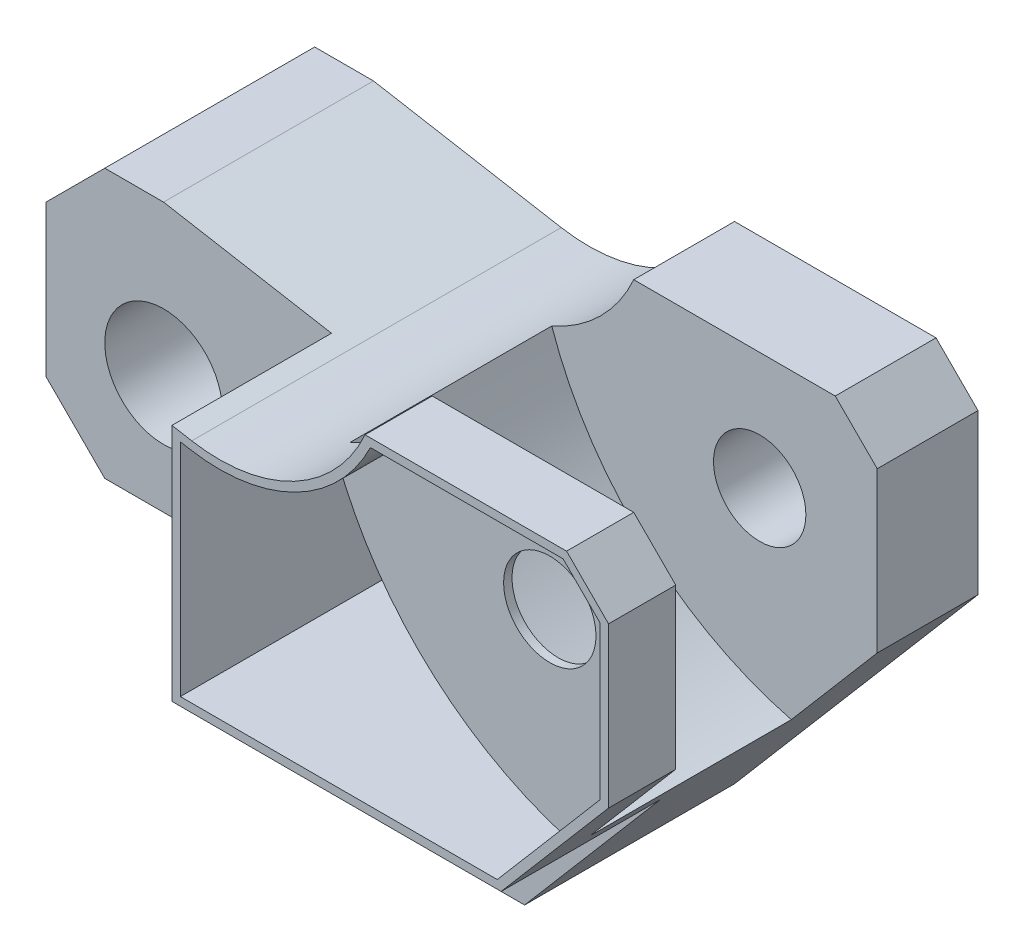
from build123d import *

# Parameters (mm, degrees)
ESQUISSE1_R              = 7
BOSS_EXTRU_2_DEPTH       = 44
ENL_V_START              = -19
ESQUISSE2_R              = 7
ENL_V_MAT_EXTRU_1_DEPTH  = 19
ENL_V_MAT_EXTRU_2_DEPTH  = 19
ESQUISSE3_R              = 5.5
ENL_V_MAT_EXTRU_3_DEPTH  = 103.815841668
ENL_V_MAT_EXTRU_21_DEPTH = 24
ENL_V_MAT_EXTRU_22_DEPTH = 7
ENL_V_MAT_EXTRU_23_DEPTH = 25


with BuildPart() as part:
    # Esquisse1 → Boss.-Extru.2 (new body)
    with BuildSketch(Plane.XY):
        with BuildLine():
            Line((40.010307264, -4.230818644), (64.010307264, -4.230818644))
            Line((64.010307264, -4.230818644), (69.010307264, -9.230818644))
            Line((69.010307264, -9.230818644), (69.010307264, -28.230818644))
            Line((69.010307264, -28.230818644), (40.010307264, -62.230818644))
            Line((40.010307264, -62.230818644), (34.307287317, -62.230818644))
            ThreePointArc((34.307287317, -62.230818644), (29.86831512, -55.346490705), (27.531484917, -47.495524527))
            ThreePointArc((27.531484917, -47.495524527), (25.851081957, -44.444232412), (22.585846175, -43.230818644))
            Line((22.585846175, -43.230818644), (-9.989692736, -43.230818644))
            Line((-9.989692736, -43.230818644), (-16.989692736, -36.230818644))
            Line((-16.989692736, -36.230818644), (-16.989692736, -18.230818644))
            Line((-16.989692736, -18.230818644), (-9.989692736, -11.230818644))
            Line((-9.989692736, -11.230818644), (-2.989692736, -11.230818644))
            Line((-2.989692736, -11.230818644), (19.3716881, -15.173733412))
            ThreePointArc((19.3716881, -15.173733412), (31.57140597, -13.248774502), (40.010307264, -4.230818644))
        make_face()
        with Locations((-2.989692736, -29.230818644)):
            Circle(ESQUISSE1_R, mode=Mode.SUBTRACT)
    extrude(amount=BOSS_EXTRU_2_DEPTH)

    # Esquisse2 → Enlèv. mat.-Extru.1 (cut)
    with BuildSketch(Plane.XY.offset(44).offset(ENL_V_START)):
        Polygon((-9.989692736, -43.230818644), (17.010307264, -43.230818644), (17.010307264, -14.757358259), (-2.989692736, -11.230818644), (-9.989692736, -11.230818644), (-16.989692736, -18.230818644), (-16.989692736, -36.230818644), align=None)
        with Locations((-2.989692736, -29.230818644)):
            Circle(ESQUISSE2_R, mode=Mode.SUBTRACT)
    extrude(amount=ENL_V_MAT_EXTRU_1_DEPTH, mode=Mode.SUBTRACT)

    # Esquisse2<4> → Enlèv. mat.-Extru.2 (cut)
    with BuildSketch(Plane.XY.offset(44)):
        Polygon((17.010307264, -43.230818644), (17.010307264, -14.757358259), (-2.989692736, -11.230818644), (-9.989692736, -11.230818644), (-16.989692736, -18.230818644), (-16.989692736, -36.230818644), (-9.989692736, -43.230818644), align=None)
        Polygon((56.216189617, -43.230818644), (40.010307264, -62.230818644), (34.307287317, -62.230818644), (29.146198459, -61.785084887), (23.052659978, -46.70921293), (22.585846175, -43.230818644), align=None)
    extrude(amount=-ENL_V_MAT_EXTRU_2_DEPTH, mode=Mode.SUBTRACT)

    # Esquisse3 → Enlèv. mat.-Extru.3 (cut, through all)
    with BuildSketch(Plane.XY.offset(44)):
        with Locations((55.010307264, -18.230818644)):
            Circle(ESQUISSE3_R)
    extrude(amount=-ENL_V_MAT_EXTRU_3_DEPTH, mode=Mode.SUBTRACT)

    # Esquisse8 → Enlèv. mat.-Extru.21 (cut)
    with BuildSketch(Plane(origin=(0, 0, 12), x_dir=(-1, 0, 0), z_dir=(0, 0, -1))):
        with BuildLine():
            ThreePointArc((-30.247243813, -13.886524027), (-36.031551607, -9.971485024), (-40.010307264, -4.230818644))
            Line((-40.010307264, -4.230818644), (-64.010307264, -4.230818644))
            Line((-64.010307264, -4.230818644), (-69.010307264, -9.230818644))
            Line((-69.010307264, -9.230818644), (-69.010307264, -28.230818644))
            Line((-69.010307264, -28.230818644), (-58.775013146, -40.230818644))
            ThreePointArc((-58.775013146, -40.230818644), (-41.194570247, -30.650113416), (-30.247243813, -13.886524027))
        make_face()
        with BuildLine():
            Line((-64.010307264, -4.230818644), (-40.010307264, -4.230818644))
            ThreePointArc((-40.010307264, -4.230818644), (-36.031551607, -9.971485024), (-30.247243813, -13.886524027))
            ThreePointArc((-30.247243813, -13.886524027), (-28.573408264, -7.300739598), (-28.010307264, -0.528945209))
            ThreePointArc((-28.010307264, -0.528945209), (-101.419002539, 24.584327589), (-58.775013146, -40.230818644))
            Line((-58.775013146, -40.230818644), (-69.010307264, -28.230818644))
            Line((-69.010307264, -28.230818644), (-69.010307264, -9.230818644))
            Line((-69.010307264, -9.230818644), (-64.010307264, -4.230818644))
        make_face()
    extrude(amount=-ENL_V_MAT_EXTRU_21_DEPTH, mode=Mode.SUBTRACT)

    # Esquisse9 → Enlèv. mat.-Extru.22 (cut)
    with BuildSketch(Plane.XY.offset(44)):
        with BuildLine():
            Line((18.010307264, -42.230818644), (55.75478356, -42.230818644))
            Line((55.75478356, -42.230818644), (68.010307264, -27.862273612))
            Line((68.010307264, -27.862273612), (68.010307264, -9.645032207))
            Line((68.010307264, -9.645032207), (63.596093702, -5.230818644))
            Line((63.596093702, -5.230818644), (40.64639195, -5.230818644))
            ThreePointArc((40.64639195, -5.230818644), (31.750313032, -14.282771566), (19.198039922, -16.158541165))
            Line((19.198039922, -16.158541165), (18.010307264, -15.949111851))
            Line((18.010307264, -15.949111851), (18.010307264, -42.230818644))
        make_face()
    extrude(amount=-ENL_V_MAT_EXTRU_22_DEPTH, mode=Mode.SUBTRACT)

    # Esquisse11 → Enlèv. mat.-Extru.23 (cut)
    with BuildSketch(Plane.XY.offset(37)):
        with BuildLine():
            Line((55.75478356, -42.230818644), (56.997155011, -40.774245219))
            ThreePointArc((56.997155011, -40.774245219), (40.320488947, -31.202946006), (29.656990207, -15.202609939))
            ThreePointArc((29.656990207, -15.202609939), (24.49138368, -16.379369207), (19.198039922, -16.158541165))
            Line((19.198039922, -16.158541165), (18.010307264, -15.949111851))
            Line((18.010307264, -15.949111851), (18.010307264, -42.230818644))
            Line((18.010307264, -42.230818644), (55.75478356, -42.230818644))
        make_face()
    extrude(amount=-ENL_V_MAT_EXTRU_23_DEPTH, mode=Mode.SUBTRACT)


solid = part.part
